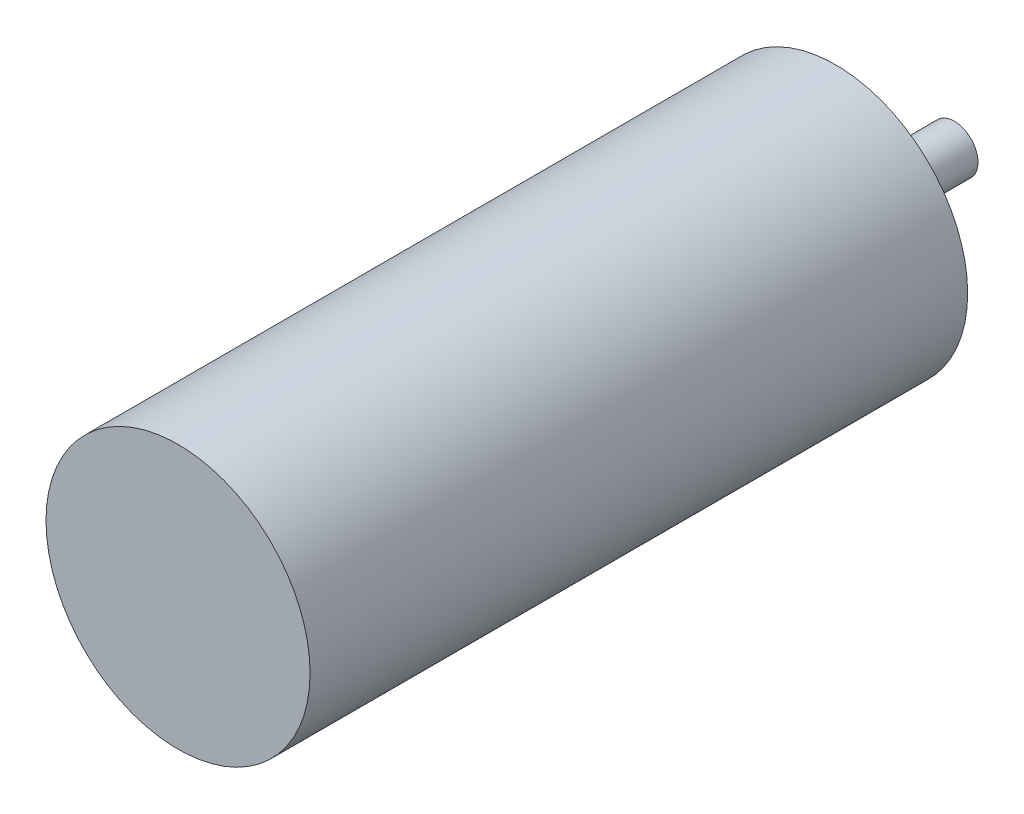
from build123d import *

# Parameters (mm, degrees)
SKETCH3_R           = 22.25
BOSS_EXTRUDE1_DEPTH = 110.79988
SKETCH4_R           = 4
BOSS_EXTRUDE2_DEPTH = 20


with BuildPart() as part:
    # Sketch3 → Boss-Extrude1 (new body)
    with BuildSketch(Plane.XY):
        Circle(SKETCH3_R)
    extrude(amount=BOSS_EXTRUDE1_DEPTH)

    # Sketch4 → Boss-Extrude2 (add)
    with BuildSketch(Plane(origin=(0, 0, 0), x_dir=(-1, 0, 0), z_dir=(0, 0, -1))):
        Circle(SKETCH4_R)
    extrude(amount=BOSS_EXTRUDE2_DEPTH)


solid = part.part
